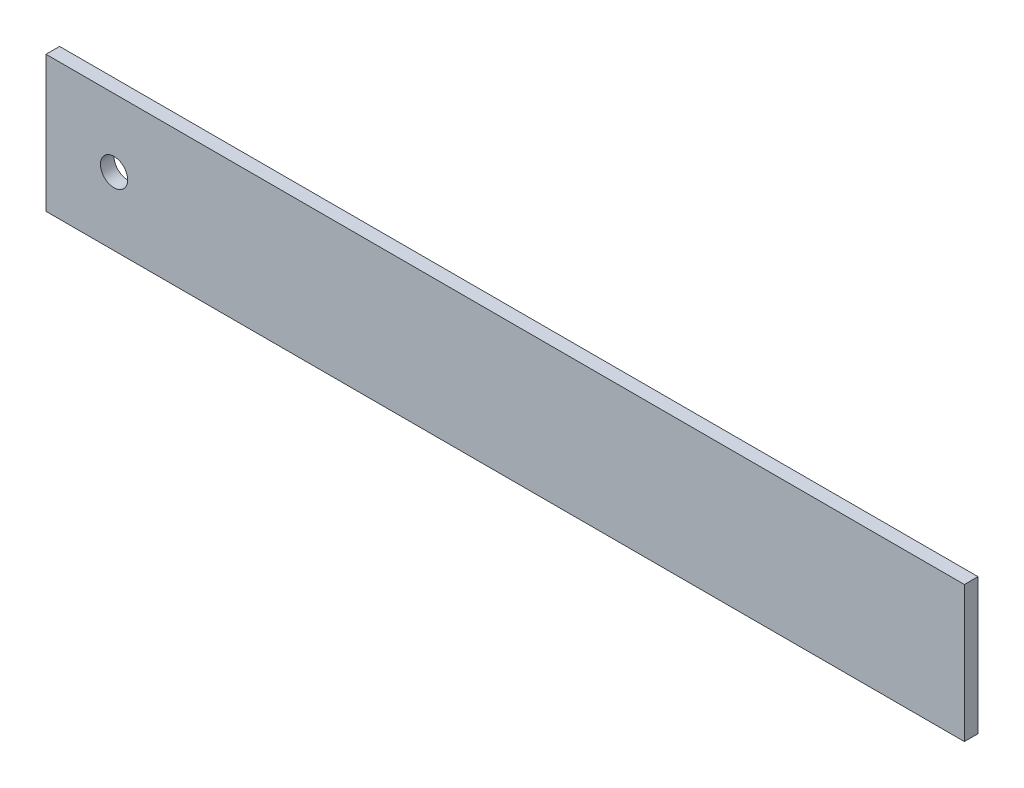
from build123d import *

# Parameters (mm, degrees)
ESQUISSE1_W             = 135
ESQUISSE1_H             = 20
BOSS_EXTRU_1_DEPTH      = 2
ESQUISSE2_R             = 2
ENL_V_MAT_EXTRU_1_DEPTH = 137.488094719


with BuildPart() as part:
    # Esquisse1 → Boss.-Extru.1 (new body)
    with BuildSketch(Plane.XY):
        with Locations((67.5, 10)):
            Rectangle(ESQUISSE1_W, ESQUISSE1_H)
    extrude(amount=BOSS_EXTRU_1_DEPTH)

    # Esquisse2 → Enlèv. mat.-Extru.1 (cut, through all)
    with BuildSketch(Plane.XY.offset(2)):
        with Locations((10, 10)):
            Circle(ESQUISSE2_R)
    extrude(amount=-ENL_V_MAT_EXTRU_1_DEPTH, mode=Mode.SUBTRACT)


solid = part.part
